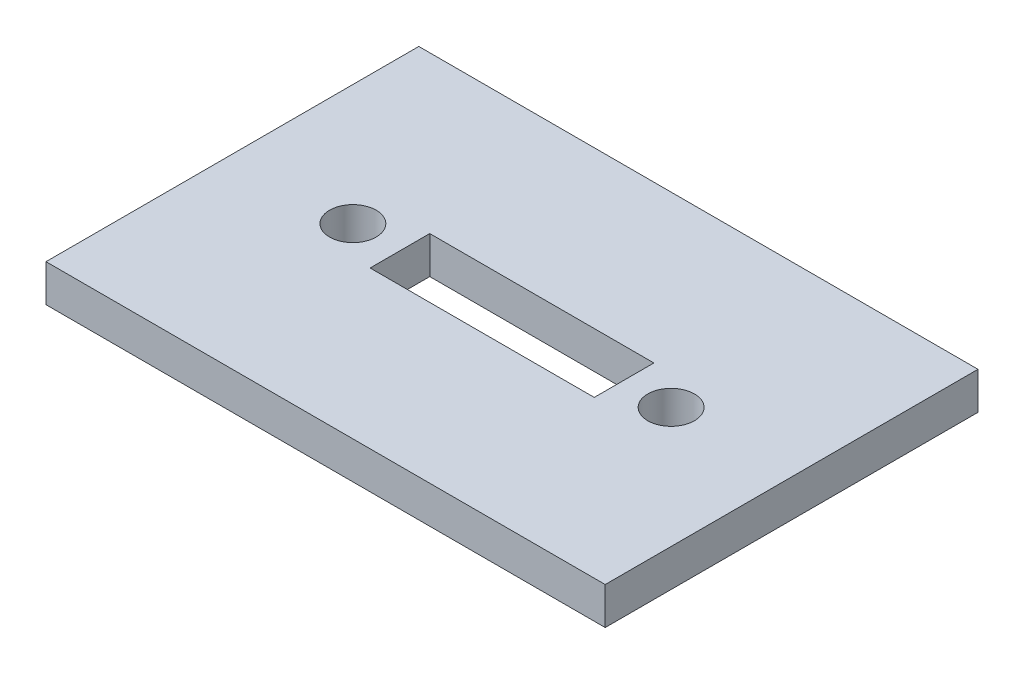
from build123d import *

# Parameters (mm, degrees)
SKETCH1_W                           = 4.7625
SKETCH1_H                           = 3.175
BOSS_EXTRUDE1_DEPTH                 = 0.3175
F_1_64_0_01563_DIAMETER_HOLE1_D     = 0.397002
F_1_64_0_01563_DIAMETER_HOLE1_DEPTH = 6.35
F_1_64_0_01563_DIAMETER_HOLE1_TIP   = 0.166562116
F_1_64_0_01563_DIAMETER_HOLE2_D     = 0.397002
F_1_64_0_01563_DIAMETER_HOLE2_DEPTH = 6.35
F_1_64_0_01563_DIAMETER_HOLE2_TIP   = 0.166562116
SKETCH9_W                           = 1.908955312
SKETCH9_H                           = 0.508
CUT_EXTRUDE1_DEPTH                  = 6.732611752


with BuildPart() as part:
    # Sketch1 → Boss-Extrude1 (new body)
    with BuildSketch(Plane(origin=(0, 0, 0), x_dir=(1, 0, 0), z_dir=(0, 1, 0))):
        with Locations((2.38125, -1.5875)):
            Rectangle(SKETCH1_W, SKETCH1_H)
    extrude(amount=BOSS_EXTRUDE1_DEPTH)

    # 1/64 (0.01563) Diameter Hole1
    with Locations(Plane(origin=(0, 0.3175, 0), x_dir=(1, 0, 0), z_dir=(0, 1, 0))):
        with Locations((1.02616, -1.5875)):
            Hole(F_1_64_0_01563_DIAMETER_HOLE1_D / 2, depth=F_1_64_0_01563_DIAMETER_HOLE1_DEPTH)
            with Locations((0, 0, -(F_1_64_0_01563_DIAMETER_HOLE1_DEPTH + F_1_64_0_01563_DIAMETER_HOLE1_TIP / 2))):  # 100° drill point
                Cone(0, F_1_64_0_01563_DIAMETER_HOLE1_D / 2, F_1_64_0_01563_DIAMETER_HOLE1_TIP, mode=Mode.SUBTRACT)

    # 1/64 (0.01563) Diameter Hole2
    with Locations(Plane(origin=(0, 0.3175, 0), x_dir=(1, 0, 0), z_dir=(0, 1, 0))):
        with Locations((3.73634, -1.5875)):
            Hole(F_1_64_0_01563_DIAMETER_HOLE2_D / 2, depth=F_1_64_0_01563_DIAMETER_HOLE2_DEPTH)
            with Locations((0, 0, -(F_1_64_0_01563_DIAMETER_HOLE2_DEPTH + F_1_64_0_01563_DIAMETER_HOLE2_TIP / 2))):  # 100° drill point
                Cone(0, F_1_64_0_01563_DIAMETER_HOLE2_D / 2, F_1_64_0_01563_DIAMETER_HOLE2_TIP, mode=Mode.SUBTRACT)

    # Sketch9 → Cut-Extrude1 (cut, through all)
    with BuildSketch(Plane(origin=(0, 0.3175, 0), x_dir=(1, 0, 0), z_dir=(0, 1, 0))):
        with Locations((2.38125, -1.5875)):
            Rectangle(SKETCH9_W, SKETCH9_H)
    extrude(amount=-CUT_EXTRUDE1_DEPTH, mode=Mode.SUBTRACT)


solid = part.part
